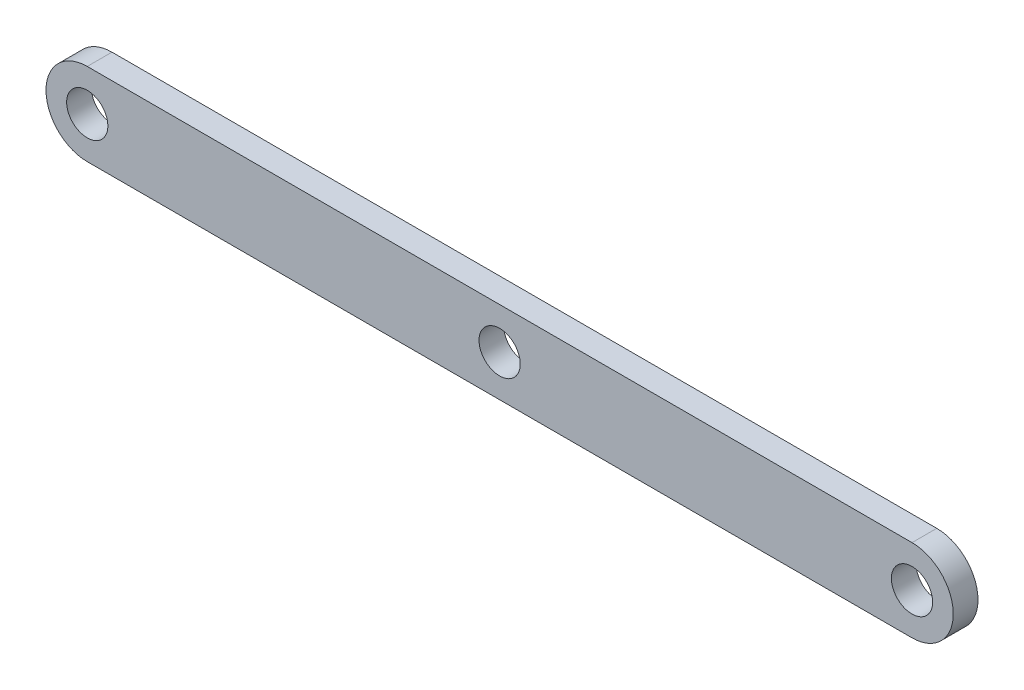
from build123d import *

# Parameters (mm, degrees)
BOSS_EXTRUDE1_DEPTH = 3
SKETCH2_R           = 2.5
CUT_EXTRUDE1_DEPTH  = 106.517771015
SKETCH3_R           = 2.5
CUT_EXTRUDE2_DEPTH  = 3


with BuildPart() as part:
    # Sketch1 → Boss-Extrude1 (new body)
    with BuildSketch(Plane.XY):
        with BuildLine():
            Line((0, 0), (100, 0))
            ThreePointArc((100, 0), (105, 5), (100, 10))
            Line((100, 10), (0, 10))
            ThreePointArc((0, 10), (-5, 5), (0, 0))
        make_face()
    extrude(amount=BOSS_EXTRUDE1_DEPTH)

    # Sketch2 → Cut-Extrude1 (cut, through all)
    with BuildSketch(Plane.XY.offset(3)):
        with Locations((0, 5)):
            Circle(SKETCH2_R)
        with Locations((100, 5)):
            Circle(SKETCH2_R)
    extrude(amount=-CUT_EXTRUDE1_DEPTH, mode=Mode.SUBTRACT)

    # Sketch3 → Cut-Extrude2 (cut)
    with BuildSketch(Plane.XY.offset(3)):
        with Locations((50, 5)):
            Circle(SKETCH3_R)
    extrude(amount=-CUT_EXTRUDE2_DEPTH, mode=Mode.SUBTRACT)


solid = part.part
